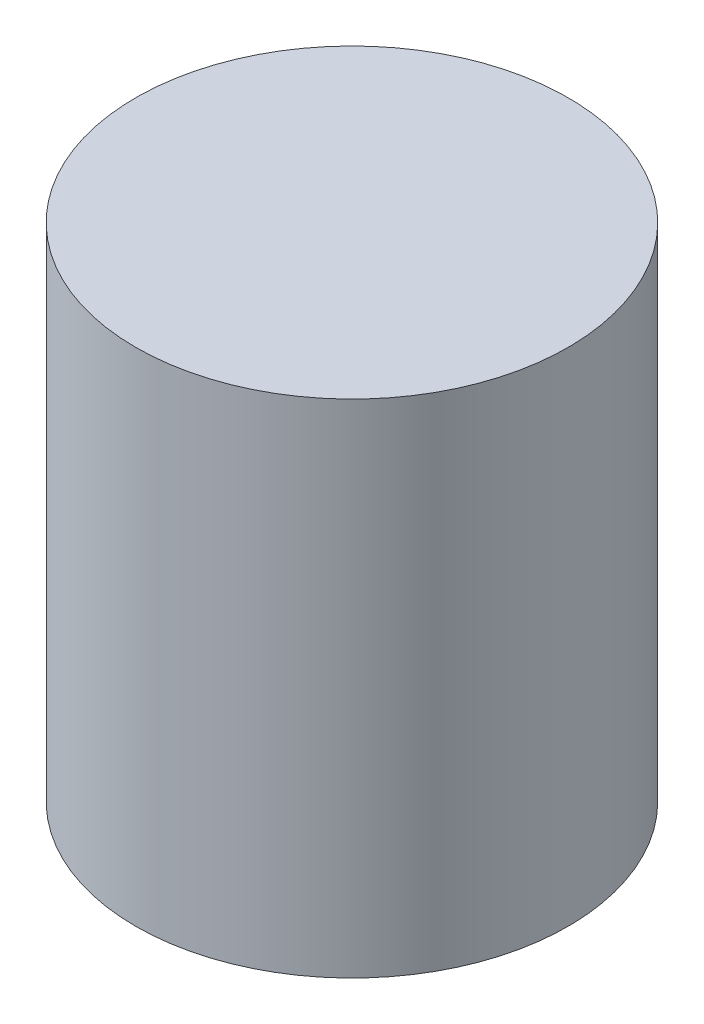
from build123d import *

# Parameters (mm, degrees)
SKETCH1_R           = 6.9
BOSS_EXTRUDE1_DEPTH = 16


with BuildPart() as part:
    # Sketch1 → Boss-Extrude1 (new body)
    with BuildSketch(Plane(origin=(0, 0, 0), x_dir=(1, 0, 0), z_dir=(0, 1, 0))):
        with Locations(Location((0, 0, 0), (0, 0, 270))):
            Circle(SKETCH1_R)
    extrude(amount=BOSS_EXTRUDE1_DEPTH)


solid = part.part
